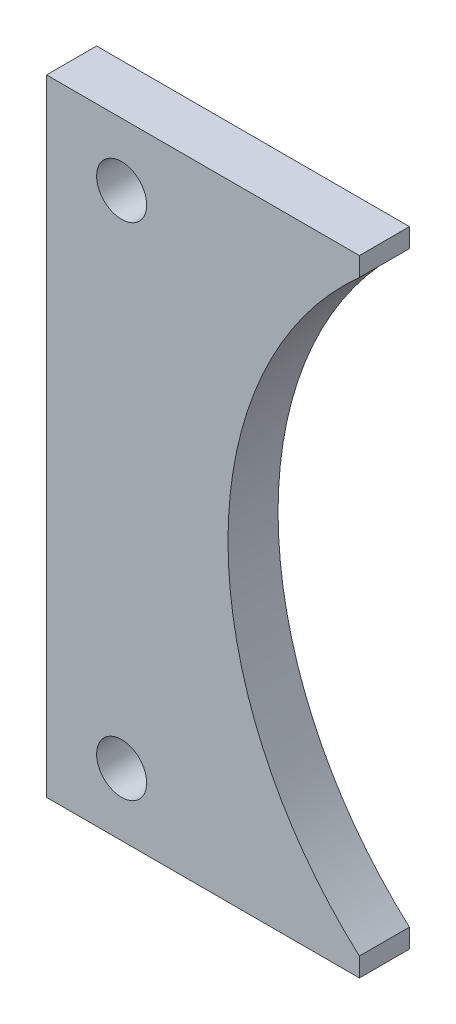
from build123d import *

# Parameters (mm, degrees)
SKETCH_1_R      = 2
EXTRUDE_1_DEPTH = 4


with BuildPart() as part:
    # 草图1 → 凸台-拉伸1 (new body)
    with BuildSketch(Plane.XY):
        with BuildLine():
            Line((-21, 23.478713764), (-21, 25))
            Line((-21, 25), (-46, 25))
            Line((-46, 25), (-46, -25))
            Line((-46, -25), (-21, -25))
            Line((-21, -25), (-21, -23.478713764))
            ThreePointArc((-21, -23.478713764), (-31.5, 0), (-21, 23.478713764))
        make_face()
        with Locations((-40, 20)):
            Circle(SKETCH_1_R, mode=Mode.SUBTRACT)
        with Locations((-40, -20)):
            Circle(SKETCH_1_R, mode=Mode.SUBTRACT)
    extrude(amount=EXTRUDE_1_DEPTH)


solid = part.part
